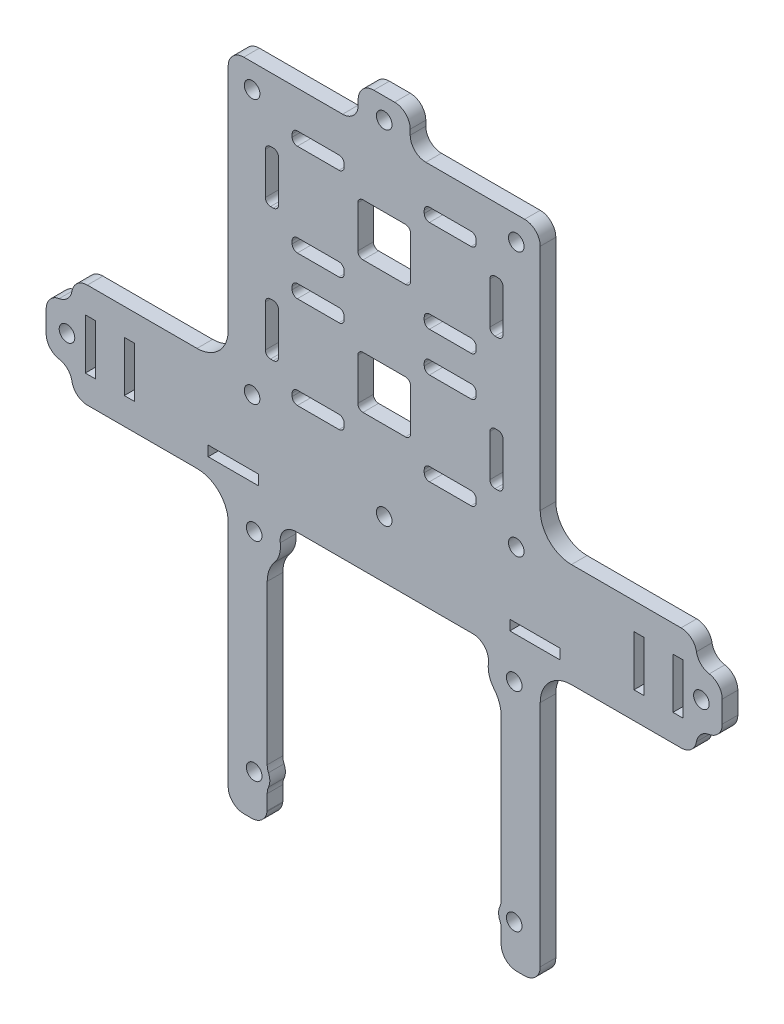
from build123d import *

# Parameters (mm, degrees)
MODEL_R         = 1.5
MODEL_W         = 9.7
MODEL_H         = 1.95
MODEL_W_2       = 1.95
MODEL_H_2       = 9.7
EXTRUDE_1_DEPTH = 3


with BuildPart() as part:
    # Model → Бобышка-Вытянуть1 (new body)
    with BuildSketch(Plane.XY):
        with BuildLine():
            Line((36, -10), (57.083920217, -10))
            ThreePointArc((57.083920217, -10), (59.02041189, -9.291287847), (60.041960108, -7.5))
            ThreePointArc((60.041960108, -7.5), (60.878679656, -5.878679656), (62.5, -5.041960108))
            ThreePointArc((62.5, -5.041960108), (64.291287847, -4.02041189), (65, -2.083920217))
            Line((65, -2.083920217), (65, 2.083920217))
            ThreePointArc((65, 2.083920217), (64.291287847, 4.02041189), (62.5, 5.041960108))
            ThreePointArc((62.5, 5.041960108), (60.878679656, 5.878679656), (60.041960108, 7.5))
            ThreePointArc((60.041960108, 7.5), (59.02041189, 9.291287847), (57.083920217, 10))
            Line((57.083920217, 10), (36, 10))
            ThreePointArc((36, 10), (31.757359313, 11.757359313), (30, 16))
            Line((30, 16), (30, 60))
            ThreePointArc((30, 60), (29.121320344, 62.121320344), (27, 63))
            Line((27, 63), (8, 63))
            ThreePointArc((8, 63), (5.878679656, 63.878679656), (5, 66))
            Line((5, 66), (5, 67))
            ThreePointArc((5, 67), (4.121320344, 69.121320344), (2, 70))
            Line((2, 70), (-2, 70))
            ThreePointArc((-2, 70), (-4.121320344, 69.121320344), (-5, 67))
            Line((-5, 67), (-5, 66))
            ThreePointArc((-5, 66), (-5.878679656, 63.878679656), (-8, 63))
            Line((-8, 63), (-27, 63))
            ThreePointArc((-27, 63), (-29.121320344, 62.121320344), (-30, 60))
            Line((-30, 60), (-30, 16))
            ThreePointArc((-30, 16), (-31.757359313, 11.757359313), (-36, 10))
            Line((-36, 10), (-57.083920217, 10))
            ThreePointArc((-57.083920217, 10), (-59.02041189, 9.291287847), (-60.041960108, 7.5))
            ThreePointArc((-60.041960108, 7.5), (-60.878679656, 5.878679656), (-62.5, 5.041960108))
            ThreePointArc((-62.5, 5.041960108), (-64.291287847, 4.02041189), (-65, 2.083920217))
            Line((-65, 2.083920217), (-65, -2.083920217))
            ThreePointArc((-65, -2.083920217), (-64.291287847, -4.02041189), (-62.5, -5.041960108))
            ThreePointArc((-62.5, -5.041960108), (-60.878679656, -5.878679656), (-60.041960108, -7.5))
            ThreePointArc((-60.041960108, -7.5), (-59.02041189, -9.291287847), (-57.083920217, -10))
            Line((-57.083920217, -10), (-36, -10))
            ThreePointArc((-36, -10), (-31.757359313, -11.757359313), (-30, -16))
            Line((-30, -16), (-30, -60))
            ThreePointArc((-30, -60), (-29.121320344, -62.121320344), (-27, -63))
            Line((-27, -63), (-25.5, -63))
            ThreePointArc((-25.5, -63), (-23.538242818, -62.269693539), (-22.531608267, -60.434339173))
            ThreePointArc((-22.531608267, -60.434339173), (-22.517149424, -60.344960408), (-22.5, -60.256058669))
            Line((-22.5, -60.256058669), (-22.5, -57.397915762))
            ThreePointArc((-22.5, -57.397915762), (-22.436835031, -56.785543326), (-22.25, -56.198957881))
            ThreePointArc((-22.25, -56.198957881), (-22, -55), (-22.25, -53.801042119))
            ThreePointArc((-22.25, -53.801042119), (-22.436835031, -53.214456674), (-22.5, -52.602084238))
            Line((-22.5, -52.602084238), (-22.5, -22.063076206))
            ThreePointArc((-22.5, -22.063076206), (-22.14306615, -20.024497184), (-21.114731857, -18.228464115))
            ThreePointArc((-21.114731857, -18.228464115), (-20.151363837, -16.417397772), (-19.987549861, -14.372598462))
            ThreePointArc((-19.987549861, -14.372598462), (-19.2599774, -12.014779028), (-17.010778055, -11))
            Line((-17.010778055, -11), (0, -11))
            Line((0, -11), (17.062746067, -11))
            ThreePointArc((17.062746067, -11), (19.312746067, -12.015686517), (20.039216292, -14.375))
            ThreePointArc((20.039216292, -14.375), (20.196344041, -16.387403843), (21.136363636, -18.173690919))
            ThreePointArc((21.136363636, -18.173690919), (22.14881323, -19.959520434), (22.5, -21.982120022))
            Line((22.5, -21.982120022), (22.5, -52.602084238))
            ThreePointArc((22.5, -52.602084238), (22.436835031, -53.214456674), (22.25, -53.801042119))
            ThreePointArc((22.25, -53.801042119), (22, -55), (22.25, -56.198957881))
            ThreePointArc((22.25, -56.198957881), (22.436835031, -56.785543326), (22.5, -57.397915762))
            Line((22.5, -57.397915762), (22.5, -60.256058669))
            ThreePointArc((22.5, -60.256058669), (22.517149424, -60.344960408), (22.531608267, -60.434339173))
            ThreePointArc((22.531608267, -60.434339173), (23.538242818, -62.269693539), (25.5, -63))
            Line((25.5, -63), (27, -63))
            ThreePointArc((27, -63), (29.121320344, -62.121320344), (30, -60))
            Line((30, -60), (30, -16))
            ThreePointArc((30, -16), (31.757359313, -11.757359313), (36, -10))
        make_face()
        with Locations((-25.4, 58.4)):
            Circle(MODEL_R, mode=Mode.SUBTRACT)
        with Locations((25.4, 7.6)):
            Circle(MODEL_R, mode=Mode.SUBTRACT)
        with Locations((-25.4, 7.6)):
            Circle(MODEL_R, mode=Mode.SUBTRACT)
        with Locations((25.4, 58.4)):
            Circle(MODEL_R, mode=Mode.SUBTRACT)
        Circle(MODEL_R, mode=Mode.SUBTRACT)
        with Locations((0, 66)):
            Circle(MODEL_R, mode=Mode.SUBTRACT)
        with Locations((61, 0)):
            Circle(MODEL_R, mode=Mode.SUBTRACT)
        with Locations((-61, 0)):
            Circle(MODEL_R, mode=Mode.SUBTRACT)
        with Locations((-25, -15)):
            Circle(MODEL_R, mode=Mode.SUBTRACT)
        with Locations((25, -15)):
            Circle(MODEL_R, mode=Mode.SUBTRACT)
        with Locations((-25, -55)):
            Circle(MODEL_R, mode=Mode.SUBTRACT)
        with Locations((25, -55)):
            Circle(MODEL_R, mode=Mode.SUBTRACT)
        with BuildLine():
            Line((5.08, 16.3), (5.08, 24.3))
            ThreePointArc((5.08, 24.3), (4.787106781, 25.007106781), (4.08, 25.3))
            Line((4.08, 25.3), (-4.08, 25.3))
            ThreePointArc((-4.08, 25.3), (-4.787106781, 25.007106781), (-5.08, 24.3))
            Line((-5.08, 24.3), (-5.08, 16.3))
            ThreePointArc((-5.08, 16.3), (-4.787106781, 15.592893219), (-4.08, 15.3))
            Line((-4.08, 15.3), (4.08, 15.3))
            ThreePointArc((4.08, 15.3), (4.787106781, 15.592893219), (5.08, 16.3))
        make_face(mode=Mode.SUBTRACT)
        with BuildLine():
            Line((5.08, 41.7), (5.08, 49.7))
            ThreePointArc((5.08, 49.7), (4.787106781, 50.407106781), (4.08, 50.7))
            Line((4.08, 50.7), (-4.08, 50.7))
            ThreePointArc((-4.08, 50.7), (-4.787106781, 50.407106781), (-5.08, 49.7))
            Line((-5.08, 49.7), (-5.08, 41.7))
            ThreePointArc((-5.08, 41.7), (-4.787106781, 40.992893219), (-4.08, 40.7))
            Line((-4.08, 40.7), (4.08, 40.7))
            ThreePointArc((4.08, 40.7), (4.787106781, 40.992893219), (5.08, 41.7))
        make_face(mode=Mode.SUBTRACT)
        with BuildLine():
            Line((16.7, 55.86), (8.7, 55.86))
            ThreePointArc((8.7, 55.86), (7.992893219, 55.567106781), (7.7, 54.86))
            Line((7.7, 54.86), (7.7, 54.32))
            ThreePointArc((7.7, 54.32), (7.992893219, 53.612893219), (8.7, 53.32))
            Line((8.7, 53.32), (16.7, 53.32))
            ThreePointArc((16.7, 53.32), (17.407106781, 53.612893219), (17.7, 54.32))
            Line((17.7, 54.32), (17.7, 54.86))
            ThreePointArc((17.7, 54.86), (17.407106781, 55.567106781), (16.7, 55.86))
        make_face(mode=Mode.SUBTRACT)
        with BuildLine():
            Line((22.86, 41.7), (22.86, 49.7))
            ThreePointArc((22.86, 49.7), (22.567106781, 50.407106781), (21.86, 50.7))
            Line((21.86, 50.7), (21.32, 50.7))
            ThreePointArc((21.32, 50.7), (20.612893219, 50.407106781), (20.32, 49.7))
            Line((20.32, 49.7), (20.32, 41.7))
            ThreePointArc((20.32, 41.7), (20.612893219, 40.992893219), (21.32, 40.7))
            Line((21.32, 40.7), (21.86, 40.7))
            ThreePointArc((21.86, 40.7), (22.567106781, 40.992893219), (22.86, 41.7))
        make_face(mode=Mode.SUBTRACT)
        with BuildLine():
            Line((22.86, 16.3), (22.86, 24.3))
            ThreePointArc((22.86, 24.3), (22.567106781, 25.007106781), (21.86, 25.3))
            Line((21.86, 25.3), (21.32, 25.3))
            ThreePointArc((21.32, 25.3), (20.612893219, 25.007106781), (20.32, 24.3))
            Line((20.32, 24.3), (20.32, 16.3))
            ThreePointArc((20.32, 16.3), (20.612893219, 15.592893219), (21.32, 15.3))
            Line((21.32, 15.3), (21.86, 15.3))
            ThreePointArc((21.86, 15.3), (22.567106781, 15.592893219), (22.86, 16.3))
        make_face(mode=Mode.SUBTRACT)
        with BuildLine():
            Line((8.7, 10.14), (16.7, 10.14))
            ThreePointArc((16.7, 10.14), (17.407106781, 10.432893219), (17.7, 11.14))
            Line((17.7, 11.14), (17.7, 11.68))
            ThreePointArc((17.7, 11.68), (17.407106781, 12.387106781), (16.7, 12.68))
            Line((16.7, 12.68), (8.7, 12.68))
            ThreePointArc((8.7, 12.68), (7.992893219, 12.387106781), (7.7, 11.68))
            Line((7.7, 11.68), (7.7, 11.14))
            ThreePointArc((7.7, 11.14), (7.992893219, 10.432893219), (8.7, 10.14))
        make_face(mode=Mode.SUBTRACT)
        with BuildLine():
            Line((16.7, 30.46), (8.7, 30.46))
            ThreePointArc((8.7, 30.46), (7.992893219, 30.167106781), (7.7, 29.46))
            Line((7.7, 29.46), (7.7, 28.92))
            ThreePointArc((7.7, 28.92), (7.992893219, 28.212893219), (8.7, 27.92))
            Line((8.7, 27.92), (16.7, 27.92))
            ThreePointArc((16.7, 27.92), (17.407106781, 28.212893219), (17.7, 28.92))
            Line((17.7, 28.92), (17.7, 29.46))
            ThreePointArc((17.7, 29.46), (17.407106781, 30.167106781), (16.7, 30.46))
        make_face(mode=Mode.SUBTRACT)
        with BuildLine():
            Line((-8.7, 30.46), (-16.7, 30.46))
            ThreePointArc((-16.7, 30.46), (-17.407106781, 30.167106781), (-17.7, 29.46))
            Line((-17.7, 29.46), (-17.7, 28.92))
            ThreePointArc((-17.7, 28.92), (-17.407106781, 28.212893219), (-16.7, 27.92))
            Line((-16.7, 27.92), (-8.7, 27.92))
            ThreePointArc((-8.7, 27.92), (-7.992893219, 28.212893219), (-7.7, 28.92))
            Line((-7.7, 28.92), (-7.7, 29.46))
            ThreePointArc((-7.7, 29.46), (-7.992893219, 30.167106781), (-8.7, 30.46))
        make_face(mode=Mode.SUBTRACT)
        with BuildLine():
            Line((-8.7, 38.08), (-16.7, 38.08))
            ThreePointArc((-16.7, 38.08), (-17.407106781, 37.787106781), (-17.7, 37.08))
            Line((-17.7, 37.08), (-17.7, 36.54))
            ThreePointArc((-17.7, 36.54), (-17.407106781, 35.832893219), (-16.7, 35.54))
            Line((-16.7, 35.54), (-8.7, 35.54))
            ThreePointArc((-8.7, 35.54), (-7.992893219, 35.832893219), (-7.7, 36.54))
            Line((-7.7, 36.54), (-7.7, 37.08))
            ThreePointArc((-7.7, 37.08), (-7.992893219, 37.787106781), (-8.7, 38.08))
        make_face(mode=Mode.SUBTRACT)
        with BuildLine():
            Line((-16.7, 10.14), (-8.7, 10.14))
            ThreePointArc((-8.7, 10.14), (-7.992893219, 10.432893219), (-7.7, 11.14))
            Line((-7.7, 11.14), (-7.7, 11.68))
            ThreePointArc((-7.7, 11.68), (-7.992893219, 12.387106781), (-8.7, 12.68))
            Line((-8.7, 12.68), (-16.7, 12.68))
            ThreePointArc((-16.7, 12.68), (-17.407106781, 12.387106781), (-17.7, 11.68))
            Line((-17.7, 11.68), (-17.7, 11.14))
            ThreePointArc((-17.7, 11.14), (-17.407106781, 10.432893219), (-16.7, 10.14))
        make_face(mode=Mode.SUBTRACT)
        with BuildLine():
            Line((-22.86, 24.3), (-22.86, 16.3))
            ThreePointArc((-22.86, 16.3), (-22.567106781, 15.592893219), (-21.86, 15.3))
            Line((-21.86, 15.3), (-21.32, 15.3))
            ThreePointArc((-21.32, 15.3), (-20.612893219, 15.592893219), (-20.32, 16.3))
            Line((-20.32, 16.3), (-20.32, 24.3))
            ThreePointArc((-20.32, 24.3), (-20.612893219, 25.007106781), (-21.32, 25.3))
            Line((-21.32, 25.3), (-21.86, 25.3))
            ThreePointArc((-21.86, 25.3), (-22.567106781, 25.007106781), (-22.86, 24.3))
        make_face(mode=Mode.SUBTRACT)
        with BuildLine():
            Line((-20.32, 41.7), (-20.32, 49.7))
            ThreePointArc((-20.32, 49.7), (-20.612893219, 50.407106781), (-21.32, 50.7))
            Line((-21.32, 50.7), (-21.86, 50.7))
            ThreePointArc((-21.86, 50.7), (-22.567106781, 50.407106781), (-22.86, 49.7))
            Line((-22.86, 49.7), (-22.86, 41.7))
            ThreePointArc((-22.86, 41.7), (-22.567106781, 40.992893219), (-21.86, 40.7))
            Line((-21.86, 40.7), (-21.32, 40.7))
            ThreePointArc((-21.32, 40.7), (-20.612893219, 40.992893219), (-20.32, 41.7))
        make_face(mode=Mode.SUBTRACT)
        with BuildLine():
            Line((8.7, 35.54), (16.7, 35.54))
            ThreePointArc((16.7, 35.54), (17.407106781, 35.832893219), (17.7, 36.54))
            Line((17.7, 36.54), (17.7, 37.08))
            ThreePointArc((17.7, 37.08), (17.407106781, 37.787106781), (16.7, 38.08))
            Line((16.7, 38.08), (8.7, 38.08))
            ThreePointArc((8.7, 38.08), (7.992893219, 37.787106781), (7.7, 37.08))
            Line((7.7, 37.08), (7.7, 36.54))
            ThreePointArc((7.7, 36.54), (7.992893219, 35.832893219), (8.7, 35.54))
        make_face(mode=Mode.SUBTRACT)
        with BuildLine():
            Line((-16.7, 53.32), (-8.7, 53.32))
            ThreePointArc((-8.7, 53.32), (-7.992893219, 53.612893219), (-7.7, 54.32))
            Line((-7.7, 54.32), (-7.7, 54.86))
            ThreePointArc((-7.7, 54.86), (-7.992893219, 55.567106781), (-8.7, 55.86))
            Line((-8.7, 55.86), (-16.7, 55.86))
            ThreePointArc((-16.7, 55.86), (-17.407106781, 55.567106781), (-17.7, 54.86))
            Line((-17.7, 54.86), (-17.7, 54.32))
            ThreePointArc((-17.7, 54.32), (-17.407106781, 53.612893219), (-16.7, 53.32))
        make_face(mode=Mode.SUBTRACT)
        with Locations((-29, -6)):
            Rectangle(MODEL_W, MODEL_H, mode=Mode.SUBTRACT)
        with Locations((29, -6)):
            Rectangle(MODEL_W, MODEL_H, mode=Mode.SUBTRACT)
        with Locations((49, 0)):
            Rectangle(MODEL_W_2, MODEL_H_2, mode=Mode.SUBTRACT)
        with Locations((-49, 0)):
            Rectangle(MODEL_W_2, MODEL_H_2, mode=Mode.SUBTRACT)
        with Locations((-56.5, 0)):
            Rectangle(MODEL_W_2, MODEL_H_2, mode=Mode.SUBTRACT)
        with Locations((56.5, 0)):
            Rectangle(MODEL_W_2, MODEL_H_2, mode=Mode.SUBTRACT)
    extrude(amount=-EXTRUDE_1_DEPTH)


solid = part.part
